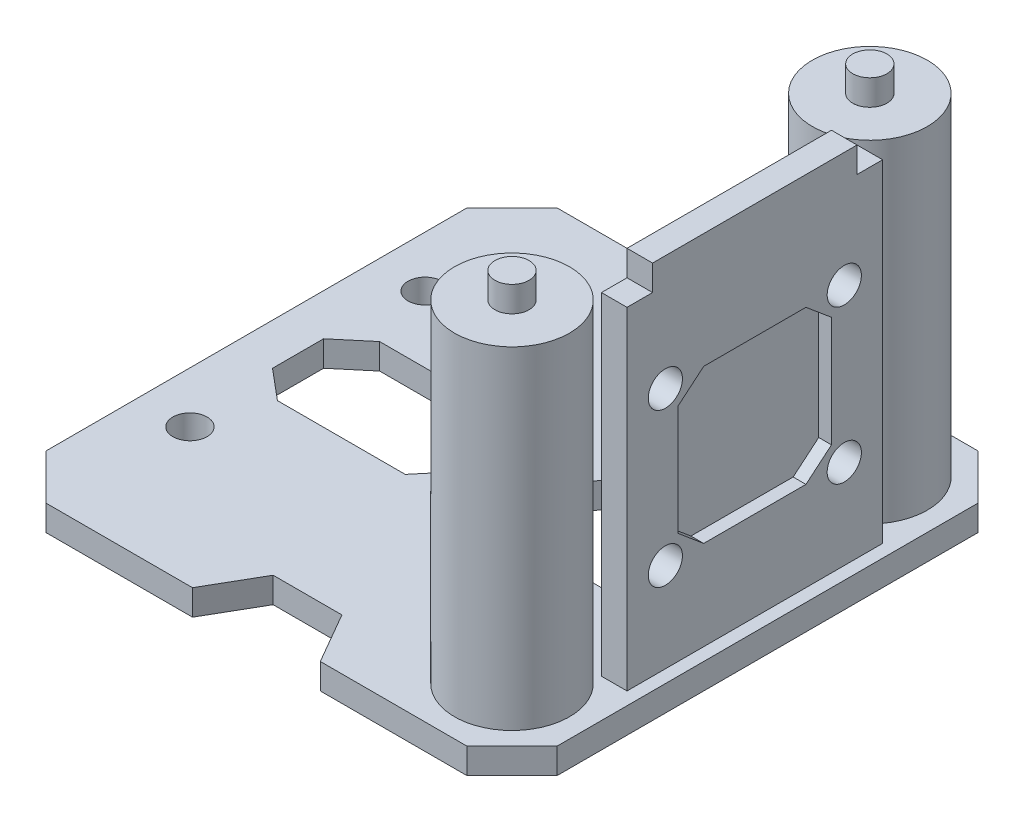
from build123d import *

# Parameters (mm, degrees)
SKETCH1_W                       = 50.8
SKETCH1_H                       = 50.8
BOSS_EXTRUDE1_DEPTH             = 2.54
HOLES_FOR_ARMS_D                = 3.4
HOLES_FOR_STRUCTURE_D           = 3.4
CORNERS_START                   = -2.54
CORNERS_DEPTH                   = 39.550715072
MIRROR_START                    = -2.54
MIRROR_OF_CORNER_2_COPY_1_DEPTH = 39.550715072
SIDE_CUTS_DEPTH                 = 2.54
CENTER_CUT_DEPTH                = 2.54
SKETCH16_R                      = 5.715
SKETCH16_R_2                    = 1.7
STANDOFFS_DEPTH                 = 33.02
SKETCH17_W                      = 2.54
SKETCH17_H                      = 25.4
BOSS_EXTRUDE2_DEPTH             = 33.02
SKETCH18_W                      = 2.54
SKETCH18_H                      = 2.54
BOSS_EXTRUDE3_DEPTH             = 2.54
CUT_EXTRUDE1_DEPTH              = 2.54
M3_CLEARANCE_HOLE1_D            = 3.4
MIRROR2_COPY_1_D                = 3.4
SKETCH23_R                      = 1.7
BOSS_EXTRUDE4_DEPTH             = 2.54
BOSS_EXTRUDE4_2_DEPTH           = 2.54
SKETCH24_W                      = 2.54
SKETCH24_H                      = 15.24
BOSS_EXTRUDE5_DEPTH             = 2.54


with BuildPart() as part:
    # Sketch1 → Boss-Extrude1 (new body)
    with BuildSketch(Plane(origin=(0, 0, 0), x_dir=(1, 0, 0), z_dir=(0, 1, 0))):
        Rectangle(SKETCH1_W, SKETCH1_H)
    extrude(amount=BOSS_EXTRUDE1_DEPTH)

    # holes for arms (through all)
    with Locations(Plane(origin=(0, 2.54, 0), x_dir=(1, 0, 0), z_dir=(0, 1, 0))):
        with Locations((-20.32, -11.684), (-20.32, 11.684)):
            Hole(HOLES_FOR_ARMS_D / 2)

    # holes for structure (through all)
    with Locations(Plane(origin=(0, 2.54, 0), x_dir=(1, 0, 0), z_dir=(0, 1, 0))):
        with Locations((17.78, -17.78), (17.78, 17.78)):
            Hole(HOLES_FOR_STRUCTURE_D / 2)

    # Sketch12 → corners (cut)
    with BuildSketch(Plane(origin=(0, 2.54, 0), x_dir=(1, 0, 0), z_dir=(0, 1, 0)).offset(CORNERS_START)):
        Polygon((-25.4, -25.4), (-20.909871939, -25.4), (-25.4, -20.909871939), align=None)
    corners = extrude(amount=CORNERS_DEPTH, mode=Mode.SUBTRACT)

    # mirror of corner: corners across plane
    add(corners.mirror(Plane.ZY), mode=Mode.SUBTRACT)

    # mirror of corner 2: corners across plane
    add(corners.mirror(Plane(origin=(0, 0, 0), x_dir=(1, 0, 0), z_dir=(0, 0, -1))), mode=Mode.SUBTRACT)

    # mirror of corner 2 copy 1 sketch → mirror of corner 2 copy 1 (cut)
    with BuildSketch(Plane(origin=(0, 2.54, 0), x_dir=(-1, 0, 0), z_dir=(0, 1, 0)).offset(MIRROR_START)):
        Polygon((-25.4, -25.4), (-20.909871939, -25.4), (-25.4, -20.909871939), align=None)
    extrude(amount=MIRROR_OF_CORNER_2_COPY_1_DEPTH, mode=Mode.SUBTRACT)

    # Sketch14 → side cuts (cut)
    with BuildSketch(Plane(origin=(0, 2.54, 0), x_dir=(1, 0, 0), z_dir=(0, 1, 0))):
        Polygon((-6.35, -25.4), (6.35, -25.4), (3.417060633, -20.32), (-3.417060633, -20.32), align=None)
        Polygon((-6.35, 25.4), (-3.417060633, 20.32), (3.417060633, 20.32), (6.35, 25.4), align=None)
    extrude(amount=-SIDE_CUTS_DEPTH, mode=Mode.SUBTRACT)

    # Sketch15 → center cut (cut)
    with BuildSketch(Plane(origin=(0, 2.54, 0), x_dir=(1, 0, 0), z_dir=(0, 1, 0))):
        Polygon((-21.259680252, 2.54), (-21.259680252, -2.54), (-18.232626126, -5.08), (-5.532626126, -5.08), (-1.27, 0), (-5.532626126, 5.08), (-18.232626126, 5.08), align=None)
    center_cut = extrude(amount=-CENTER_CUT_DEPTH, mode=Mode.SUBTRACT)

    # mirror of center cut: center cut across plane
    add(center_cut.mirror(Plane.ZY), mode=Mode.SUBTRACT)

    # Sketch16 → standoffs (add)
    # profile 1 of 2: a face of its own
    with BuildSketch(Plane(origin=(0, 2.54, 0), x_dir=(1, 0, 0), z_dir=(0, 1, 0))):
        with Locations(Location((17.78, -17.78, 0), (0, 0, 90))):
            Circle(SKETCH16_R)
        with Locations(Location((17.78, -17.78, 0), (0, 0, 270))):
            Circle(SKETCH16_R_2, mode=Mode.SUBTRACT)
    # profile 2 of 2: a face of its own
    with BuildSketch(Plane(origin=(0, 2.54, 0), x_dir=(1, 0, 0), z_dir=(0, 1, 0))):
        with Locations(Location((17.78, 17.78, 0), (0, 0, 90))):
            Circle(SKETCH16_R)
        with Locations(Location((17.78, 17.78, 0), (0, 0, 270))):
            Circle(SKETCH16_R_2, mode=Mode.SUBTRACT)
    extrude(amount=STANDOFFS_DEPTH)

    # Sketch17 → Boss-Extrude2 (add)
    with BuildSketch(Plane(origin=(0, 2.54, 0), x_dir=(1, 0, 0), z_dir=(0, 1, 0))):
        with Locations((22.86, 0)):
            Rectangle(SKETCH17_W, SKETCH17_H)
    extrude(amount=BOSS_EXTRUDE2_DEPTH)

    # Sketch18 → Boss-Extrude3 (add)
    with BuildSketch(Plane(origin=(0, 35.56, 0), x_dir=(1, 0, 0), z_dir=(0, 1, 0))):
        with Locations((22.86, -8.89)):
            Rectangle(SKETCH18_W, SKETCH18_H)
        with Locations((22.86, 8.89)):
            Rectangle(SKETCH18_W, SKETCH18_H)
    extrude(amount=BOSS_EXTRUDE3_DEPTH)

    # Sketch19 → Cut-Extrude1 (cut)
    with BuildSketch(Plane(origin=(25.4, 0, 0), x_dir=(0, 0, -1), z_dir=(1, 0, 0))):
        Polygon((-7.62, 13.561313063), (-7.62, 24.538686937), (-5.08, 26.67), (5.08, 26.67), (7.62, 24.538686937), (7.62, 13.561313063), (5.08, 11.43), (-5.08, 11.43), align=None)
    extrude(amount=-CUT_EXTRUDE1_DEPTH, mode=Mode.SUBTRACT)

    # M3 Clearance Hole1 (through all)
    with Locations(Plane(origin=(24.13, 0, 0), x_dir=(0, 0, -1), z_dir=(1, 0, 0))):
        with Locations((-8.89, 26.67)):
            m3_clearance_hole1 = Hole(M3_CLEARANCE_HOLE1_D / 2)

    # Mirror1: M3 Clearance Hole1 across plane
    add(m3_clearance_hole1.mirror(Plane(origin=(0, 0, 0), x_dir=(1, 0, 0), z_dir=(0, 0, -1))), mode=Mode.SUBTRACT)

    # Mirror2: M3 Clearance Hole1 across plane
    add(m3_clearance_hole1.mirror(Plane.ZX.offset(19.05)), mode=Mode.SUBTRACT)

    # Mirror2 copy 1 (through all)
    with Locations(Plane(origin=(24.13, 38.1, 0), x_dir=(0, 0, 1), z_dir=(1, 0, 0))):
        with Locations((-8.89, 26.67)):
            Hole(MIRROR2_COPY_1_D / 2)

    # Sketch24 → Boss-Extrude5 (add)
    with BuildSketch(Plane(origin=(0, 35.56, 0), x_dir=(1, 0, 0), z_dir=(0, 1, 0))):
        with Locations((22.86, 0)):
            Rectangle(SKETCH24_W, SKETCH24_H)
    extrude(amount=BOSS_EXTRUDE5_DEPTH)


with BuildPart() as body_2:
    # Sketch23 → Boss-Extrude4 (new body)
    with BuildSketch(Plane(origin=(0, 35.56, 0), x_dir=(1, 0, 0), z_dir=(0, 1, 0))):
        with Locations(Location((17.78, -17.78, 0), (0, 0, 270))):
            Circle(SKETCH23_R)
    extrude(amount=BOSS_EXTRUDE4_DEPTH)


with BuildPart() as body_3:
    # Sketch23 → Boss-Extrude4 2 (new body)
    with BuildSketch(Plane(origin=(0, 35.56, 0), x_dir=(1, 0, 0), z_dir=(0, 1, 0))):
        with Locations(Location((17.78, 17.78, 0), (0, 0, 90))):
            Circle(SKETCH23_R)
    extrude(amount=BOSS_EXTRUDE4_2_DEPTH)


solid = Compound([part.part, body_2.part, body_3.part])
